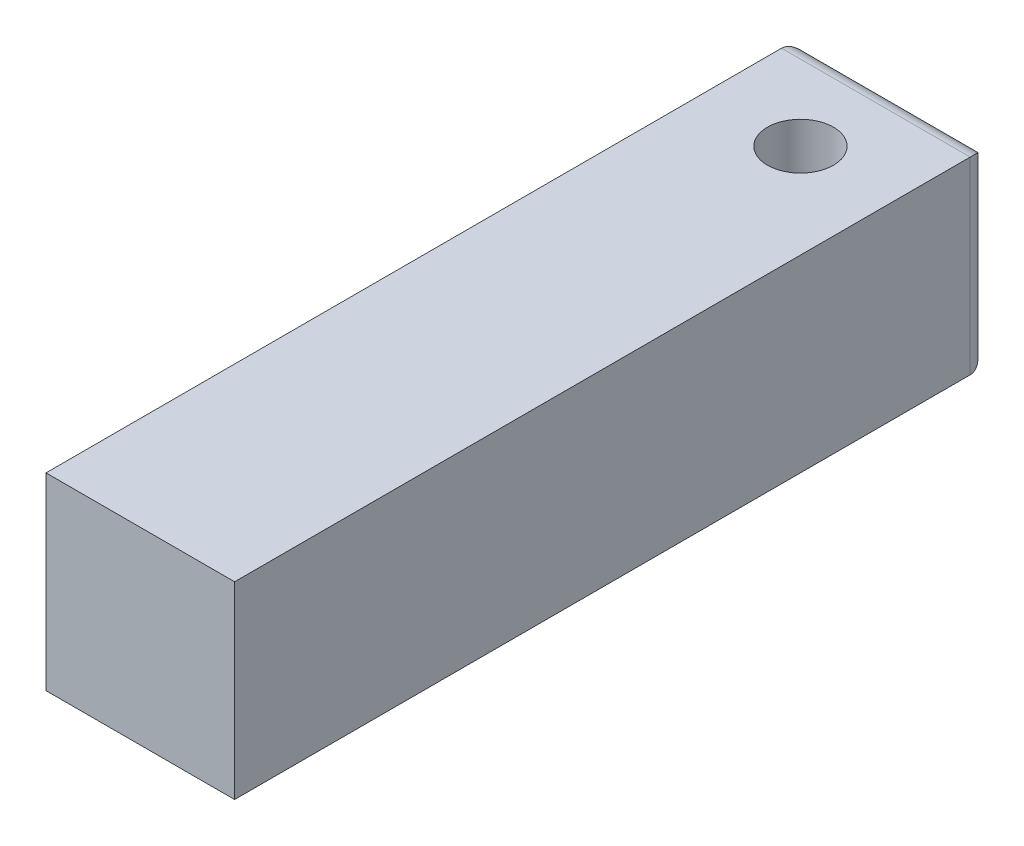
from build123d import *

# Parameters (mm, degrees)
SKIZZE1_W                       = 10
SKIZZE1_H                       = 40
SKIZZE1_R                       = 1.75
AUFSATZ_LINEAR_AUSTRAGEN1_DEPTH = 10
VERRUNDUNG1_R                   = 1


with BuildPart() as part:
    # Skizze1 → Aufsatz-Linear austragen1 (new body)
    with BuildSketch(Plane(origin=(0, 0, 0), x_dir=(1, 0, 0), z_dir=(0, 1, 0))):
        with Locations((-5, 20)):
            Rectangle(SKIZZE1_W, SKIZZE1_H)
        with Locations(Location((-5, 35, 0), (0, 0, 270))):
            Circle(SKIZZE1_R, mode=Mode.SUBTRACT)
    extrude(amount=-AUFSATZ_LINEAR_AUSTRAGEN1_DEPTH)

    # Verrundung1
    verrundung1_edges = [part.edges().sort_by_distance(p)[0] for p in [
        (-5, 0, -40),
        (-5, -10, -40),
        (-10, -5, -40),
        (0, -5, -40),
    ]]
    fillet(verrundung1_edges, radius=VERRUNDUNG1_R)


solid = part.part
